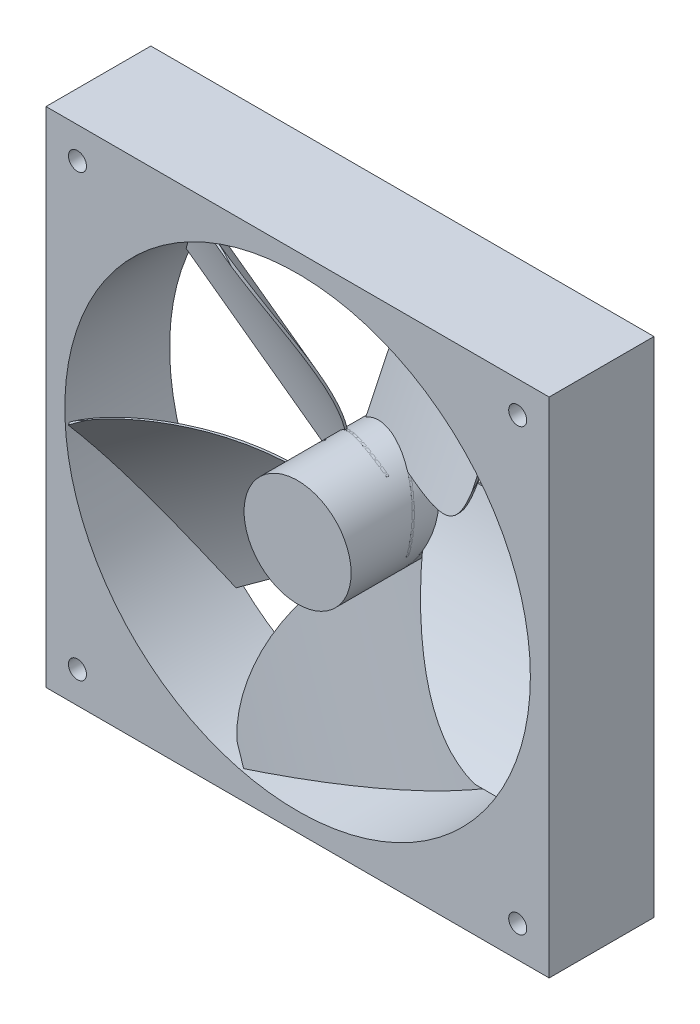
from build123d import *

# Parameters (mm, degrees)
SKICA1_W                         = 120
SKICA1_H                         = 120
P_IDAT_VYSUNUT_M1_DEPTH          = 25
SKICA2_R                         = 2.15
ODEBRAT_VYSUNUT_M1_DEPTH         = 89.459030065
SKICA3_R                         = 55.516334554
SKICA3_R_2                       = 12.765487508
ODEBRAT_VYSUNUT_M2_DEPTH         = 89.459030065
VYSUNOUT_TENKOST_NN_1_REACH      = 90.459
VYSUNOUT_TENKOST_NN_1_END_RADIUS = 55.516334554
ODEBRAT_VYSUNUT_M9_REACH         = 90.459
KRUHOV_POLE1_COUNT               = 5


with BuildPart() as part:
    # Skica1 → Přidat vysunutím1 (new body)
    with BuildSketch(Plane.XY):
        Rectangle(SKICA1_W, SKICA1_H)
    extrude(amount=P_IDAT_VYSUNUT_M1_DEPTH)

    # Skica2 → Odebrat vysunutím1 (cut, through all)
    with BuildSketch(Plane.XY):
        with Locations((-52.5, 52.5)):
            Circle(SKICA2_R)
        with Locations((52.5, 52.5)):
            Circle(SKICA2_R)
        with Locations((52.5, -52.5)):
            Circle(SKICA2_R)
        with Locations((-52.5, -52.5)):
            Circle(SKICA2_R)
    extrude(amount=ODEBRAT_VYSUNUT_M1_DEPTH, mode=Mode.SUBTRACT)

    # Skica3 → Odebrat vysunutím2 (cut, through all)
    with BuildSketch(Plane.XY):
        Circle(SKICA3_R)
        Circle(SKICA3_R_2, mode=Mode.SUBTRACT)
    extrude(amount=ODEBRAT_VYSUNUT_M2_DEPTH, mode=Mode.SUBTRACT)


with BuildPart() as odebrat_vysunut_m2_piece_1:
    # of the separate pieces the step leaves, piece 1, a body of its own (odebrat_vysunut_m2_pieces)
    add(part.part.solids().sort_by_distance((-60, 60, 0))[0])


with BuildPart() as odebrat_vysunut_m2_piece_2:
    # of the separate pieces the step leaves, piece 2, a body of its own (odebrat_vysunut_m2_pieces)
    add(part.part.solids().sort_by_distance((12.765487508, 0, 0))[0])


with BuildPart() as body_3:
    # Vysunout tenkostěnný1: up to this cylinder (the profile starts inside it)
    vysunout_tenkost_nn_1_end = Plane(origin=(0, 0, 1.362206), z_dir=(0, 0, -1)) * Cylinder(VYSUNOUT_TENKOST_NN_1_END_RADIUS, 292.950669109, mode=Mode.PRIVATE)
    # Skica5 → Vysunout tenkostěnný1 (new, up to the surface)
    with BuildSketch(Plane(origin=(0, 0, 0), x_dir=(0, 0, -1), z_dir=(1, 0, 0)), mode=Mode.PRIVATE) as vysunout_tenkost_nn_1_sk1:
        with BuildLine():
            ThreePointArc((-1, 10), (-9.901923789, -11.418584287), (-24, -29.837168574))
            Line((-24, -29.837168574), (-24.354398894, -29.484462714))
            ThreePointArc((-24.354398894, -29.484462714), (-10.334936491, -11.168584287), (-1.482651682, 10.130565515))
            Line((-1.482651682, 10.130565515), (-1, 10))
        make_face()
    vysunout_tenkost_nn_1_tool1 = extrude(vysunout_tenkost_nn_1_sk1.sketch, amount=VYSUNOUT_TENKOST_NN_1_REACH, mode=Mode.PRIVATE) & vysunout_tenkost_nn_1_end
    add(vysunout_tenkost_nn_1_tool1.solids().sort_by_distance((0, 9.618435, 1.362206))[0])

    # Odebrat vysunutím9: up to this plane
    odebrat_vysunut_m9_end = Plane(origin=(60.001, -29.837168574, 24), z_dir=(0, -0.7087977880444921, 0.7054117206732783))
    # Skica6 → Odebrat vysunutím9 (cut, up to the surface)
    with BuildSketch(Plane.XY, mode=Mode.PRIVATE) as odebrat_vysunut_m9_sk1:
        with BuildLine():
            Line((0, -12.765487508), (0, -29.837168574))
            Line((0, -29.837168574), (46.816736044, -29.837168574))
            ThreePointArc((46.816736044, -29.837168574), (25.313591416, -22.95603796), (11.800266061, -4.869434485))
            ThreePointArc((11.800266061, -4.869434485), (7.099188906, -10.60939151), (0, -12.765487508))
        make_face()
    odebrat_vysunut_m9_tool1 = split(extrude(odebrat_vysunut_m9_sk1.sketch, amount=ODEBRAT_VYSUNUT_M9_REACH, mode=Mode.PRIVATE), bisect_by=odebrat_vysunut_m9_end, keep=Keep.BOTH, mode=Mode.PRIVATE)
    add(odebrat_vysunut_m9_tool1.solids().sort_by_distance((13.189806, -21.64057, 0))[0], mode=Mode.SUBTRACT)


with BuildPart() as kruhov_pole1_1:
    # Kruhové pole1: pattern copy
    add(body_3.part.rotate(Axis((0, 0, 0), (0, 0, 1)), 1 * 360 / KRUHOV_POLE1_COUNT))


with BuildPart() as kruhov_pole1_2:
    # Kruhové pole1: pattern copy
    add(body_3.part.rotate(Axis((0, 0, 0), (0, 0, 1)), 2 * 360 / KRUHOV_POLE1_COUNT))


with BuildPart() as kruhov_pole1_3:
    # Kruhové pole1: pattern copy
    add(body_3.part.rotate(Axis((0, 0, 0), (0, 0, 1)), 3 * 360 / KRUHOV_POLE1_COUNT))


with BuildPart() as kruhov_pole1_4:
    # Kruhové pole1: pattern copy
    add(body_3.part.rotate(Axis((0, 0, 0), (0, 0, 1)), 4 * 360 / KRUHOV_POLE1_COUNT))


solid = Compound([odebrat_vysunut_m2_piece_1.part, odebrat_vysunut_m2_piece_2.part, body_3.part, kruhov_pole1_1.part, kruhov_pole1_2.part, kruhov_pole1_3.part, kruhov_pole1_4.part])
